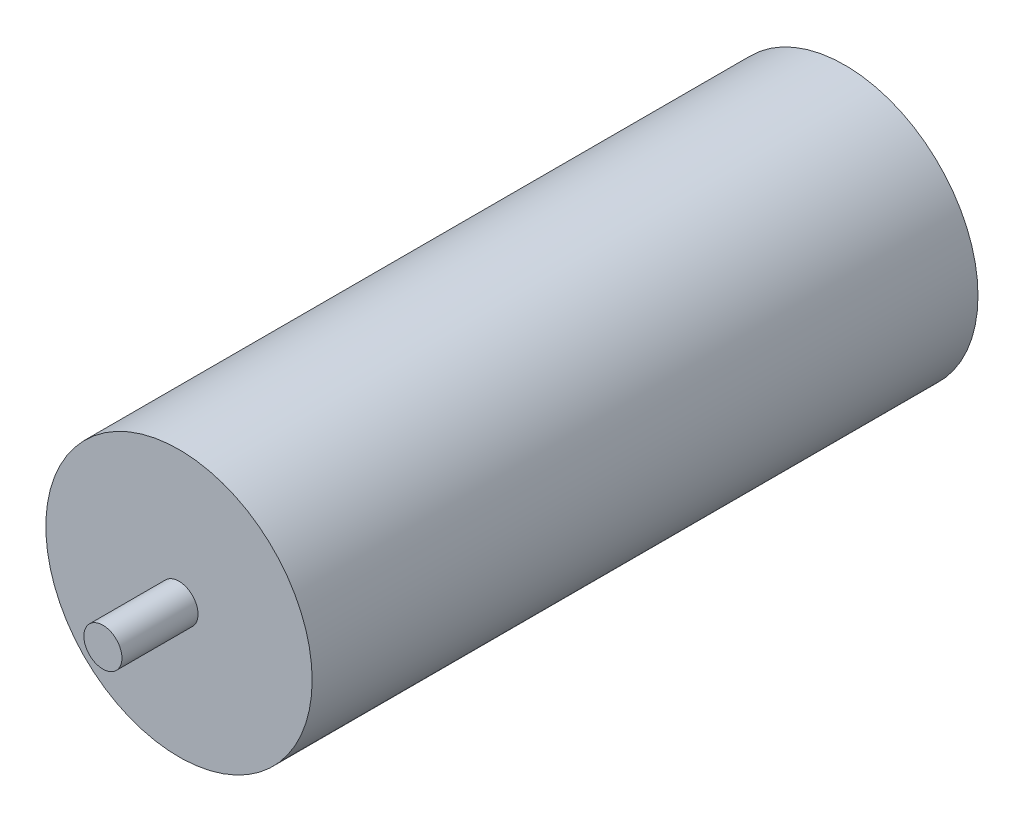
from build123d import *

# Parameters (mm, degrees)
SKETCH1_R           = 35
BOSS_EXTRUDE1_DEPTH = 87.5
SKETCH2_R           = 5
BOSS_EXTRUDE2_DEPTH = 20


with BuildPart() as part:
    # Sketch1 → Boss-Extrude1 (new, symmetric)
    with BuildSketch(Plane.XY):
        Circle(SKETCH1_R)
    extrude(amount=BOSS_EXTRUDE1_DEPTH, both=True)

    # Sketch2 → Boss-Extrude2 (add)
    with BuildSketch(Plane.XY.offset(87.5)):
        Circle(SKETCH2_R)
    boss_extrude2 = extrude(amount=BOSS_EXTRUDE2_DEPTH)

    # Mirror1: Boss-Extrude2 across plane
    add(boss_extrude2.mirror(Plane.XY))


solid = part.part
